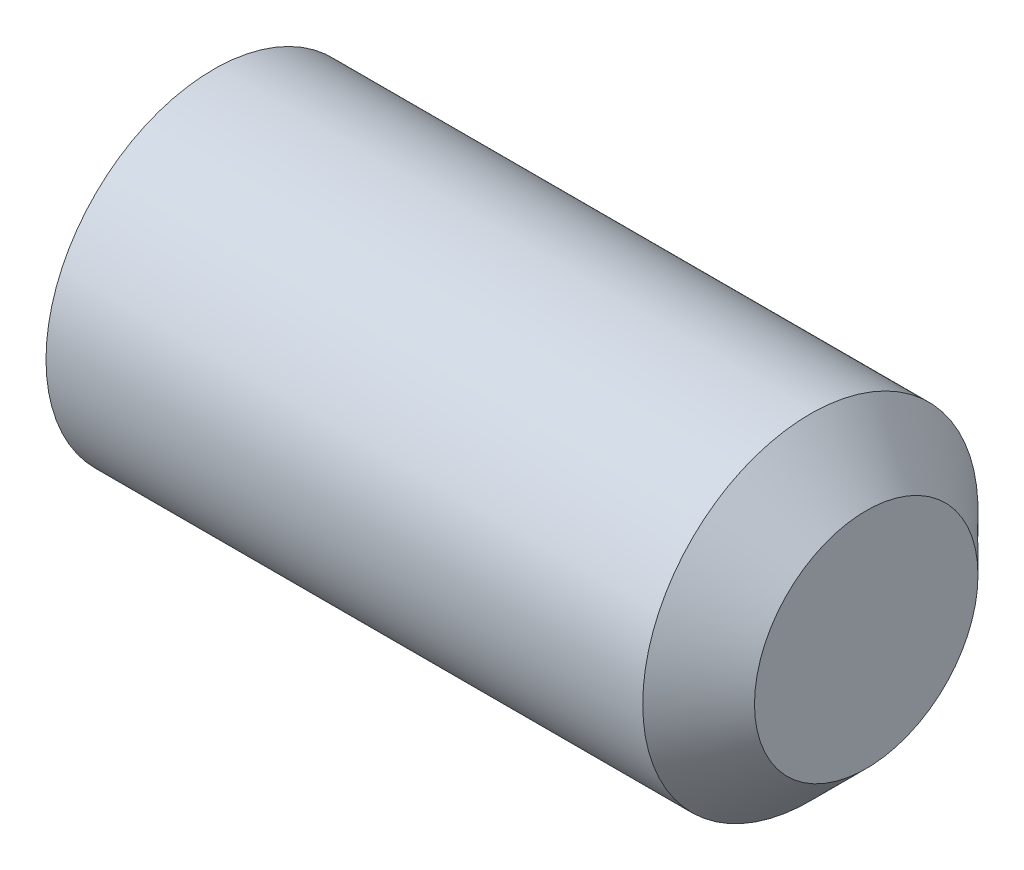
from build123d import *

# Parameters (mm, degrees)
HEX_2_DEPTH = 3.5


with BuildPart() as part:
    # BodySke → BaseBody (revolve)
    with BuildSketch(Plane.XY, mode=Mode.PRIVATE) as basebody_sk:
        Polygon((0, 0), (0, 2.4455), (0.320140724, 3), (11, 3), (12, 2), (12, 0), align=None)
    revolve(basebody_sk.sketch.rotate(Axis((-12.7, 0, 0), (1, 0, 0)), 90), axis=Axis((-12.7, 0, 0), (1, 0, 0)))

    # Sketch2 → Hex 2 (cut)
    with BuildSketch(Plane.ZY):
        Polygon((0.866025404, 1.5), (-0.866025404, 1.5), (-1.732050808, 0), (-0.866025404, -1.5), (0.866025404, -1.5), (1.732050808, 0), align=None)
    extrude(amount=-HEX_2_DEPTH, mode=Mode.SUBTRACT)


solid = part.part
